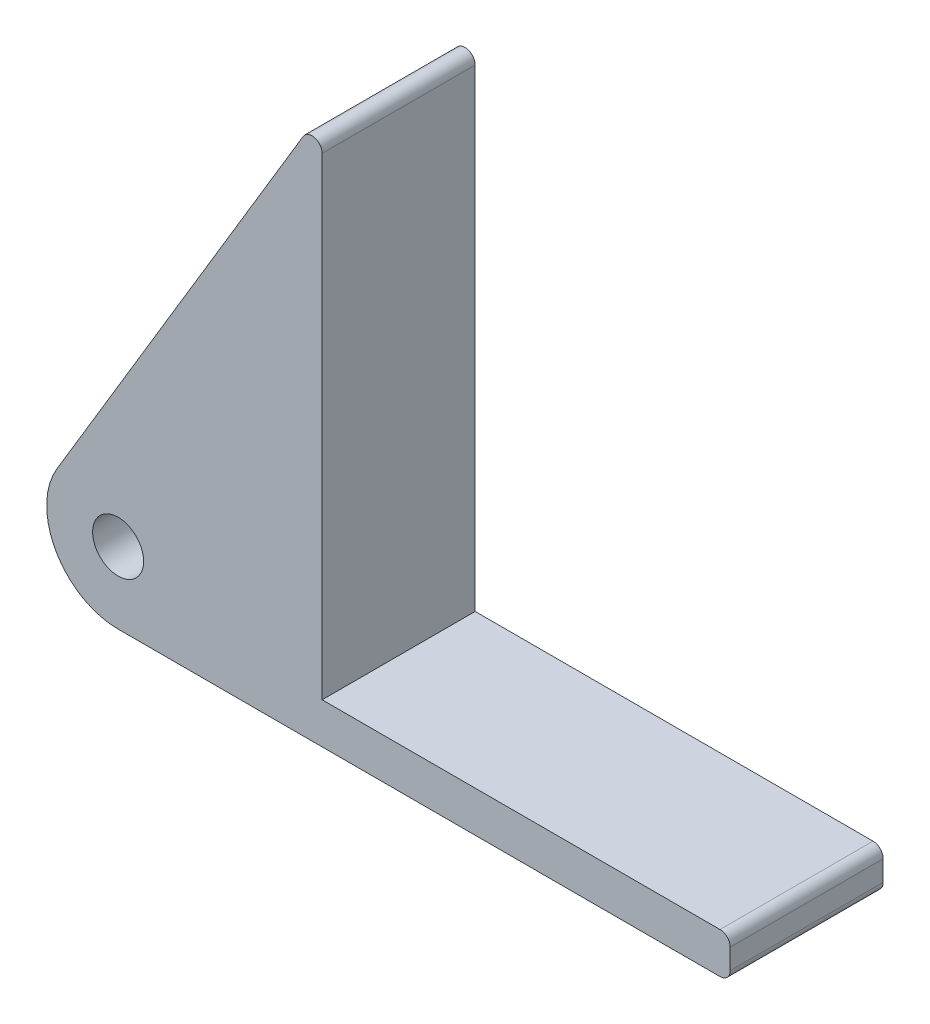
from build123d import *

# Parameters (mm, degrees)
ESQUISSE1_R        = 2.5
BOSS_EXTRU_1_DEPTH = 15
CONG_1_R           = 1


with BuildPart() as part:
    # Esquisse1 → Boss.-Extru.1 (new body)
    with BuildSketch(Plane.XY):
        with BuildLine():
            Line((20, -3), (20, 47))
            Line((20, 47), (-6.004687468, 3.597739348))
            ThreePointArc((-6.004687468, 3.597739348), (-6.09032739, -3.4507843), (0, -7))
            Line((0, -7), (60, -7))
            Line((60, -7), (60, -3))
            Line((60, -3), (20, -3))
        make_face()
        Circle(ESQUISSE1_R, mode=Mode.SUBTRACT)
    extrude(amount=-BOSS_EXTRU_1_DEPTH)

    # Congé1
    cong_1_edges = [part.edges().sort_by_distance(p)[0] for p in [
        (60, -3, -7.5),
        (60, -7, -7.5),
        (20, 47, -7.5),
    ]]
    fillet(cong_1_edges, radius=CONG_1_R)


solid = part.part
